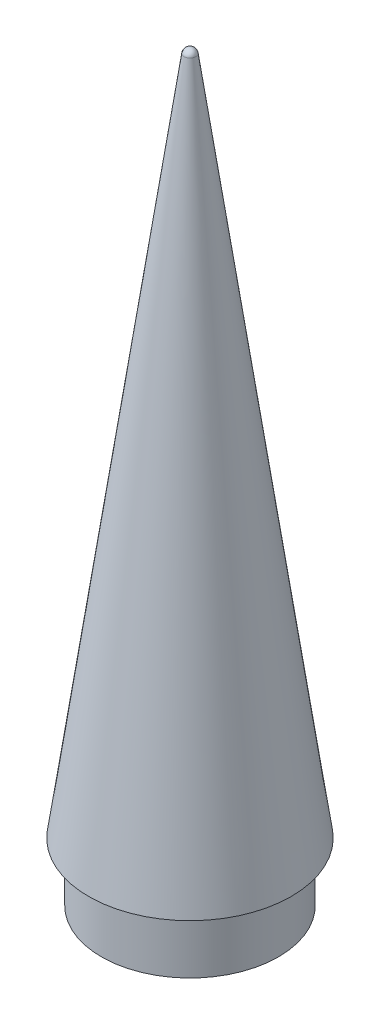
from build123d import *

# Parameters (mm, degrees)
TAP_DRILL_FOR_1_4_20_TAP1_D     = 5.1054
TAP_DRILL_FOR_1_4_20_TAP1_DEPTH = 19.05
TAP_DRILL_FOR_1_4_20_TAP1_TIP   = 1.533816902


with BuildPart() as part:
    # Sketch2 → Revolve1 (revolve)
    with BuildSketch(Plane.XY):
        with BuildLine():
            Line((21.9329, 12.7), (1.257640447, 159.812115824))
            ThreePointArc((1.257640447, 159.812115824), (0.833194967, 160.593847152), (0, 160.905365985))
            Line((0, 160.905365985), (0, 0))
            Line((0, 0), (19.177, 0))
            Line((19.177, 0), (19.177, 12.7))
            Line((19.177, 12.7), (21.9329, 12.7))
        make_face()
    revolve(axis=Axis((0, 0, 0), (0, 1, 0)))

    # Tap Drill for 1/4-20 Tap1
    with Locations(Plane(origin=(0, 0, 0), x_dir=(-1, 0, 0), z_dir=(0, -1, 0))):
        with Locations((0, 0)):
            Hole(TAP_DRILL_FOR_1_4_20_TAP1_D / 2, depth=TAP_DRILL_FOR_1_4_20_TAP1_DEPTH)
            with Locations((0, 0, -(TAP_DRILL_FOR_1_4_20_TAP1_DEPTH + TAP_DRILL_FOR_1_4_20_TAP1_TIP / 2))):  # 118° drill point
                Cone(0, TAP_DRILL_FOR_1_4_20_TAP1_D / 2, TAP_DRILL_FOR_1_4_20_TAP1_TIP, mode=Mode.SUBTRACT)


solid = part.part
